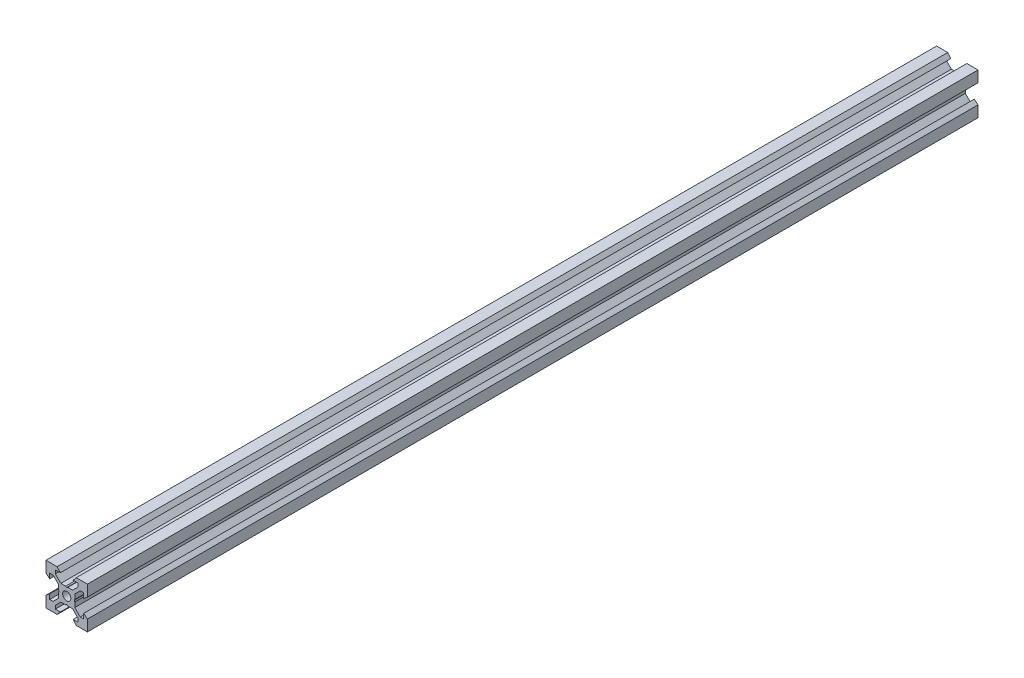
from build123d import *

# Parameters (mm, degrees)
SKETCH1_R           = 2
BOSS_EXTRUDE1_DEPTH = 215


with BuildPart() as part:
    # Sketch1 → Boss-Extrude1 (new, symmetric)
    with BuildSketch(Plane.XY):
        Polygon((10, 10), (10, 4.610379336), (8.2, 3.1), (8.2, 5.5), (6.560660172, 5.5), (3.9, 2.839339828), (3.9, 0.519615242), (3.6, 0), (3.9, -0.519615242), (3.9, -2.839339828), (6.560660172, -5.5), (8.2, -5.5), (8.2, -3.1), (10, -4.610379336), (10, -10), (4.610379336, -10), (3.1, -8.2), (5.5, -8.2), (5.5, -6.560660172), (2.839339828, -3.9), (0.519615242, -3.9), (0, -3.6), (-0.519615242, -3.9), (-2.839339828, -3.9), (-5.5, -6.560660172), (-5.5, -8.2), (-3.1, -8.2), (-4.610379336, -10), (-10, -10), (-10, -4.610379336), (-8.2, -3.1), (-8.2, -5.5), (-6.560660172, -5.5), (-3.9, -2.839339828), (-3.9, -0.519615242), (-3.6, 0), (-3.9, 0.519615242), (-3.9, 2.839339828), (-6.560660172, 5.5), (-8.2, 5.5), (-8.2, 3.1), (-10, 4.610379336), (-10, 10), (-4.610379336, 10), (-3.1, 8.2), (-5.5, 8.2), (-5.5, 6.560660172), (-2.839339828, 3.9), (-0.519615242, 3.9), (0, 3.6), (0.519615242, 3.9), (2.839339828, 3.9), (5.5, 6.560660172), (5.5, 8.2), (3.1, 8.2), (4.610379336, 10), align=None)
        Circle(SKETCH1_R, mode=Mode.SUBTRACT)
    extrude(amount=BOSS_EXTRUDE1_DEPTH, both=True)


solid = part.part
